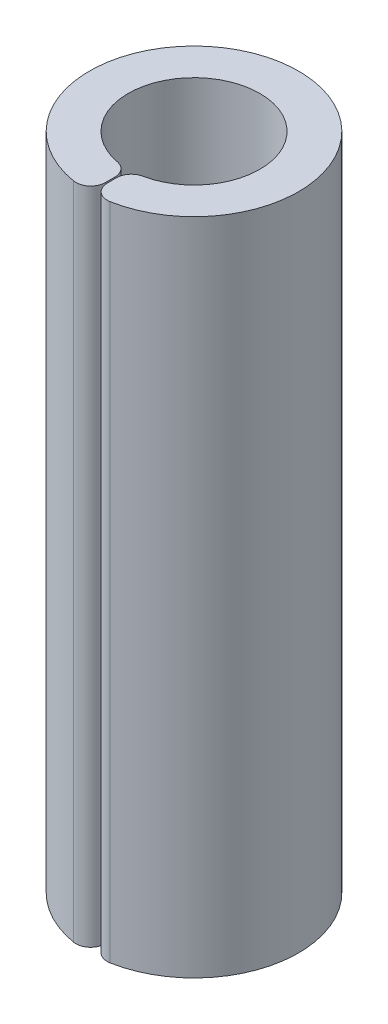
from build123d import *

# Parameters (mm, degrees)
BOSS_EXTRUDE1_DEPTH = 26.8
FILLET1_R           = 0.6


with BuildPart() as part:
    # Sketch1 → Boss-Extrude1 (new body)
    with BuildSketch(Plane(origin=(0, 0, 0), x_dir=(1, 0, 0), z_dir=(0, 1, 0))):
        with BuildLine():
            Line((0.046685187, -2.674592585), (0.074172727, -4.249352704))
            ThreePointArc((0.074172727, -4.249352704), (-0.037087776, 4.249838173), (0, -4.25))
            Line((0, -4.25), (0, -2.675))
            ThreePointArc((0, -2.675), (-0.023343482, 2.674898144), (0.046685187, -2.674592585))
        make_face()
    extrude(amount=BOSS_EXTRUDE1_DEPTH)

    # Fillet1
    fillet1_edges = [part.edges().sort_by_distance(p)[0] for p in [
        (0, 13.4, 2.675),
        (0, 13.4, 4.25),
        (0.074172727, 13.4, 4.249352704),
        (0.046685187, 13.4, 2.674592585),
    ]]
    fillet(fillet1_edges, radius=FILLET1_R)


solid = part.part
